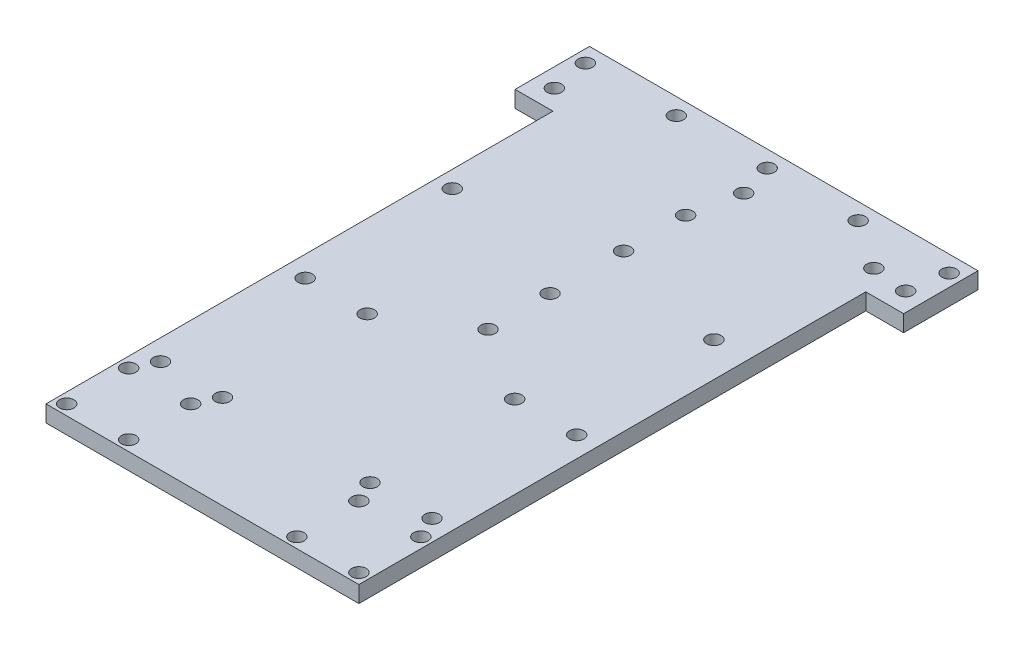
from build123d import *
from build123d.topology import SkipClean

# Parameters (mm, degrees)
SKETCH1_W           = 75.7
SKETCH1_H           = 42.7
SKETCH1_R           = 1.75
BOSS_EXTRUDE1_DEPTH = 4
SKETCH3_W           = 75.7
SKETCH3_H           = 29.75
SKETCH3_R           = 1.75
BOSS_EXTRUDE2_DEPTH = 4
SKETCH3_3_R         = 1.75
CUT_EXTRUDE1_DEPTH  = 4
SKETCH4_W           = 75.7
SKETCH4_H           = 40
SKETCH4_R           = 1.75
BOSS_EXTRUDE3_DEPTH = 4
BOSS_EXTRUDE4_DEPTH = 4
SKETCH6_3_R         = 1.75
CUT_EXTRUDE2_DEPTH  = 103.587572347
SKETCH7_W           = 9.15
SKETCH7_H           = 10
SKETCH7_R           = 1.75
BOSS_EXTRUDE5_DEPTH = 4
SKETCH8_W           = 75.7
SKETCH8_H           = 20.2
BOSS_EXTRUDE6_DEPTH = 4
SKETCH9_R           = 1.75
CUT_EXTRUDE3_DEPTH  = 121.882959924


with BuildPart() as part:
    # Sketch1 → Boss-Extrude1 (new body)
    with BuildSketch(Plane(origin=(0, 0, 0), x_dir=(1, 0, 0), z_dir=(0, 1, 0))):
        Rectangle(SKETCH1_W, SKETCH1_H)
        with Locations((2.4, 17.25)):
            Circle(SKETCH1_R, mode=Mode.SUBTRACT)
        with Locations((-33.8, -17.05)):
            Circle(SKETCH1_R, mode=Mode.SUBTRACT)
        with Locations((29.5, -17.05)):
            Circle(SKETCH1_R, mode=Mode.SUBTRACT)
        with Locations((33.9, 17.25)):
            Circle(SKETCH1_R, mode=Mode.SUBTRACT)
    extrude(amount=BOSS_EXTRUDE1_DEPTH)

    # Sketch3 → Boss-Extrude2 (add)
    with BuildSketch(Plane(origin=(0, 4, 0), x_dir=(1, 0, 0), z_dir=(0, 1, 0))):
        with Locations((0, -36.225)):
            Rectangle(SKETCH3_W, SKETCH3_H)
        with Locations((0, -42.2)):
            Circle(SKETCH3_R, mode=Mode.SUBTRACT)
        with Locations((0, -27.2)):
            Circle(SKETCH3_R, mode=Mode.SUBTRACT)
    extrude(amount=-BOSS_EXTRUDE2_DEPTH)

    # Sketch3<3> → Cut-Extrude1 (cut)
    with BuildSketch(Plane(origin=(0, 4, 0), x_dir=(1, 0, 0), z_dir=(0, 1, 0))):
        with Locations((0, 5.6)):
            Circle(SKETCH3_3_R)
        with Locations((0, -9.4)):
            Circle(SKETCH3_3_R)
    extrude(amount=-CUT_EXTRUDE1_DEPTH, mode=Mode.SUBTRACT)

    # Sketch4 → Boss-Extrude3 (add)
    # profile 1 of 2: a face of its own
    with BuildSketch(Plane(origin=(0, 0, 0), x_dir=(1, 0, 0), z_dir=(0, 1, 0))):
        with Locations((0, -71.1)):
            Rectangle(SKETCH4_W, SKETCH4_H)
        with Locations((-32.85, -53.6)):
            Circle(SKETCH4_R, mode=Mode.SUBTRACT)
        with Locations((-17.85, -53.6)):
            Circle(SKETCH4_R, mode=Mode.SUBTRACT)
        with Locations((-17.85, -88.6)):
            Circle(SKETCH4_R, mode=Mode.SUBTRACT)
        with Locations((-32.85, -88.6)):
            Circle(SKETCH4_R, mode=Mode.SUBTRACT)
        with Locations((32.85, -88.6)):
            Circle(SKETCH4_R, mode=Mode.SUBTRACT)
        with Locations((17.85, -88.6)):
            Circle(SKETCH4_R, mode=Mode.SUBTRACT)
        with Locations((17.85, -53.6)):
            Circle(SKETCH4_R, mode=Mode.SUBTRACT)
        with Locations((32.85, -53.6)):
            Circle(SKETCH4_R, mode=Mode.SUBTRACT)
    # profile 2 of 2: a face of its own
    with BuildSketch(Plane(origin=(0, 0, 0), x_dir=(1, 0, 0), z_dir=(0, 1, 0))):
        Polygon((-37.85, 21.35), (-44, 21.35), (-44, 29.35), (44, 29.35), (44, 21.35), (37.85, 21.35), align=None)
    extrude(amount=BOSS_EXTRUDE3_DEPTH)

    # Sketch6 → Boss-Extrude4 (add)
    with BuildSketch(Plane(origin=(0, 4, 0), x_dir=(1, 0, 0), z_dir=(0, 1, 0))):
        with BuildLine():
            Line((-44, 27.1), (-44, 29.35))
            Line((-44, 29.35), (-47, 29.35))
            Line((-47, 29.35), (-47, 21.35))
            Line((-47, 21.35), (-44, 21.35))
            Line((-44, 21.35), (-44, 23.6))
            ThreePointArc((-44, 23.6), (-45.75, 25.35), (-44, 27.1))
        make_face()
        with BuildLine():
            Line((47, 29.35), (44, 29.35))
            Line((44, 29.35), (44, 27.1))
            ThreePointArc((44, 27.1), (45.75, 25.35), (44, 23.6))
            Line((44, 23.6), (44, 21.35))
            Line((44, 21.35), (47, 21.35))
            Line((47, 21.35), (47, 29.35))
        make_face()
    extrude(amount=-BOSS_EXTRUDE4_DEPTH)

    # Sketch6<3> → Cut-Extrude2 (cut, through all)
    with SkipClean():  # the faces are left unmerged after this step: merging them gives an invalid solid
        with BuildSketch(Plane(origin=(0, 4, 0), x_dir=(1, 0, 0), z_dir=(0, 1, 0))):
            with Locations((0, 25.35)):
                Circle(SKETCH6_3_R)
            with Locations((22, 25.35)):
                Circle(SKETCH6_3_R)
            with Locations((44, 25.35)):
                Circle(SKETCH6_3_R)
            with Locations((-22, 25.35)):
                Circle(SKETCH6_3_R)
            with Locations((-44, 25.35)):
                Circle(SKETCH6_3_R)
        extrude(amount=-CUT_EXTRUDE2_DEPTH, mode=Mode.SUBTRACT)

    # Sketch7 → Boss-Extrude5 (add)
    # profile 1 of 2: a face of its own
    with SkipClean():  # the faces are left unmerged after this step: merging them gives an invalid solid
        with BuildSketch(Plane(origin=(0, 0, 0), x_dir=(1, 0, 0), z_dir=(0, 1, 0))):
            with Locations((-42.425, 16.35)):
                Rectangle(SKETCH7_W, SKETCH7_H)
            with Locations((-42.5, 16.35)):
                Circle(SKETCH7_R, mode=Mode.SUBTRACT)
        # profile 2 of 2: a face of its own
        with BuildSketch(Plane(origin=(0, 0, 0), x_dir=(1, 0, 0), z_dir=(0, 1, 0))):
            with Locations((42.425, 16.35)):
                Rectangle(SKETCH7_W, SKETCH7_H)
            with Locations((42.5, 16.35)):
                Circle(SKETCH7_R, mode=Mode.SUBTRACT)
        extrude(amount=BOSS_EXTRUDE5_DEPTH)

    # Sketch8 → Boss-Extrude6 (add)
    with SkipClean():  # the faces are left unmerged after this step: merging them gives an invalid solid
        with BuildSketch(Plane(origin=(0, 0, 0), x_dir=(1, 0, 0), z_dir=(0, 1, 0))):
            with Locations((0, -101.2)):
                Rectangle(SKETCH8_W, SKETCH8_H)
        extrude(amount=BOSS_EXTRUDE6_DEPTH)

    # Sketch9 → Cut-Extrude3 (cut, through all)
    with SkipClean():  # the faces are left unmerged after this step: merging them gives an invalid solid
        with BuildSketch(Plane(origin=(0, 4, 0), x_dir=(1, 0, 0), z_dir=(0, 1, 0))):
            with Locations((-35.35, -93.8)):
                Circle(SKETCH9_R)
            with Locations((-20.35, -93.8)):
                Circle(SKETCH9_R)
            with Locations((-20.35, -108.8)):
                Circle(SKETCH9_R)
            with Locations((-35.35, -108.8)):
                Circle(SKETCH9_R)
        cut_extrude3 = extrude(amount=-CUT_EXTRUDE3_DEPTH, mode=Mode.SUBTRACT)

    # Mirror1: Cut-Extrude3 across plane
    with SkipClean():  # the faces are left unmerged after this step: merging them gives an invalid solid
        add(cut_extrude3.mirror(Plane(origin=(0, 0, 0), x_dir=(0, 0, 1), z_dir=(1, 0, 0))), mode=Mode.SUBTRACT)


solid = part.part
